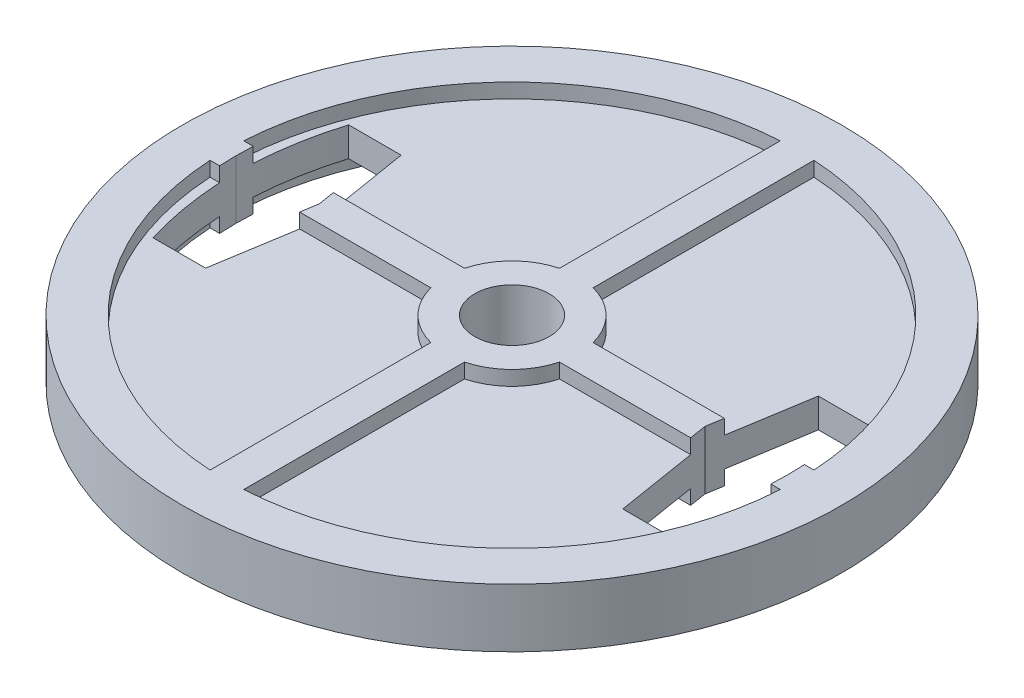
from build123d import *

# Parameters (mm, degrees)
SKETCH1_R               = 225
SKETCH1_R_2             = 25.4
BOSS_EXTRUDE1_DEPTH     = 20
CUT_EXTRUDE1_DEPTH      = 319.825971339
CUT_EXTRUDE1_DEPTH_BACK = 319.825971339
CUT_EXTRUDE2_START      = 20
CUT_EXTRUDE2_DEPTH      = 10


with BuildPart() as part:
    # Sketch1 → Boss-Extrude1 (new body)
    with BuildSketch(Plane(origin=(0, 0, 0), x_dir=(1, 0, 0), z_dir=(0, 1, 0))):
        with Locations(Location((0, 0, 0), (0, 0, 270))):
            Circle(SKETCH1_R)
        with Locations(Location((0, 0, 0), (0, 0, 270))):
            Circle(SKETCH1_R_2, mode=Mode.SUBTRACT)
    extrude(amount=BOSS_EXTRUDE1_DEPTH)

    # Sketch2 → Cut-Extrude1 (cut, two sides: drawn at the far end of the back side and taken through both)
    with BuildSketch(Plane(origin=(0, 0, 0), x_dir=(1, 0, 0), z_dir=(0, 1, 0)).offset(-CUT_EXTRUDE1_DEPTH_BACK)):
        with BuildLine():
            Line((-178.258542487, 66.764776795), (-142.42023427, 66.764776795))
            Line((-142.42023427, 66.764776795), (-131.611855601, 0))
            Line((-131.611855601, 0), (-142.42023427, -66.764776795))
            Line((-142.42023427, -66.764776795), (-178.258542487, -66.764776795))
            add(Edge.make_bspline(
                [(-188.498059121, 0), (-188.498059121, -23.199214205), (-184.204279862, -48.203238876), (-178.258542487, -66.764776795)],
                knots=[0, 0, 0, 0, 1, 1, 1, 1], degree=3))
            add(Edge.make_bspline(
                [(-188.498059121, 0), (-188.498059121, 23.199214205), (-184.204279862, 48.203238876), (-178.258542487, 66.764776795)],
                knots=[0, 0, 0, 0, 1, 1, 1, 1], degree=3))
        make_face()
        with BuildLine():
            Line((178.258542487, -66.764776795), (142.42023427, -66.764776795))
            Line((142.42023427, -66.764776795), (131.611855601, 0))
            Line((131.611855601, 0), (142.42023427, 66.764776795))
            Line((142.42023427, 66.764776795), (178.258542487, 66.764776795))
            add(Edge.make_bspline(
                [(188.498059121, 0), (188.498059121, 23.199214205), (184.204279862, 48.203238876), (178.258542487, 66.764776795)],
                knots=[0, 0, 0, 0, 1, 1, 1, 1], degree=3))
            add(Edge.make_bspline(
                [(188.498059121, 0), (188.498059121, -23.199214205), (184.204279862, -48.203238876), (178.258542487, -66.764776795)],
                knots=[0, 0, 0, 0, 1, 1, 1, 1], degree=3))
        make_face()
    extrude(amount=CUT_EXTRUDE1_DEPTH + CUT_EXTRUDE1_DEPTH_BACK, mode=Mode.SUBTRACT)

    # Sketch3 → Cut-Extrude2 (cut)
    with BuildSketch(Plane(origin=(0, 0, 0), x_dir=(1, 0, 0), z_dir=(0, 1, 0)).offset(CUT_EXTRUDE2_START)):
        with BuildLine():
            Line((-11.5, 43.919357919), (-11.5, 194.660602074))
            ThreePointArc((-11.5, 194.660602074), (-137.885822331, 137.885822331), (-194.660602074, 11.5))
            Line((-194.660602074, 11.5), (-43.919357919, 11.5))
            ThreePointArc((-43.919357919, 11.5), (-32.102647866, 32.102647866), (-11.5, 43.919357919))
        make_face()
        with BuildLine():
            Line((11.5, 43.919357919), (11.5, 194.660602074))
            ThreePointArc((11.5, 194.660602074), (137.885822331, 137.885822331), (194.660602074, 11.5))
            Line((194.660602074, 11.5), (43.919357919, 11.5))
            ThreePointArc((43.919357919, 11.5), (32.102647866, 32.102647866), (11.5, 43.919357919))
        make_face()
        with BuildLine():
            Line((43.919357919, -11.5), (194.660602074, -11.5))
            ThreePointArc((194.660602074, -11.5), (137.885822331, -137.885822331), (11.5, -194.660602074))
            Line((11.5, -194.660602074), (11.5, -43.919357919))
            ThreePointArc((11.5, -43.919357919), (32.102647866, -32.102647866), (43.919357919, -11.5))
        make_face()
        with BuildLine():
            Line((-11.5, -43.919357919), (-11.5, -194.660602074))
            ThreePointArc((-11.5, -194.660602074), (-137.885822331, -137.885822331), (-194.660602074, -11.5))
            Line((-194.660602074, -11.5), (-43.919357919, -11.5))
            ThreePointArc((-43.919357919, -11.5), (-32.102647866, -32.102647866), (-11.5, -43.919357919))
        make_face()
    extrude(amount=-CUT_EXTRUDE2_DEPTH, mode=Mode.SUBTRACT)

    # Mirror2: part across plane


with BuildPart() as part_1:
    add(part.part)
    add(part.part.mirror(Plane.ZX))


solid = part_1.part
